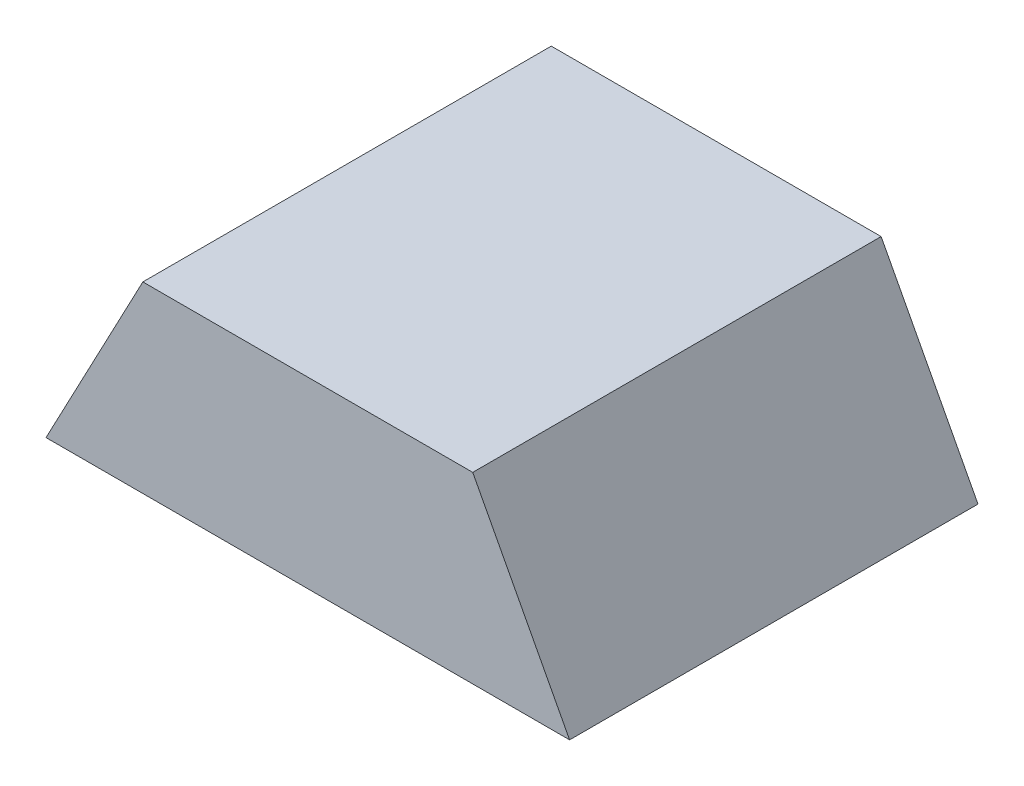
from build123d import *

# Parameters (mm, degrees)
BOSS_EXTRUDE1_DEPTH = 780
SHELL1_T            = -6


with BuildPart() as part:
    # Sketch2 → Boss-Extrude1 (new body)
    with BuildSketch(Plane.XY):
        Polygon((2473.731171405, 0), (3473.731171405, 0), (3288.731171405, 350), (2658.731171405, 350), align=None)
    extrude(amount=BOSS_EXTRUDE1_DEPTH)

    # Shell1
    shell1_openings = [part.faces().sort_by_distance(p)[0] for p in [
        (2973.731171405, 0, 390),
    ]]
    offset(amount=SHELL1_T, openings=shell1_openings, kind=Kind.INTERSECTION)


solid = part.part
